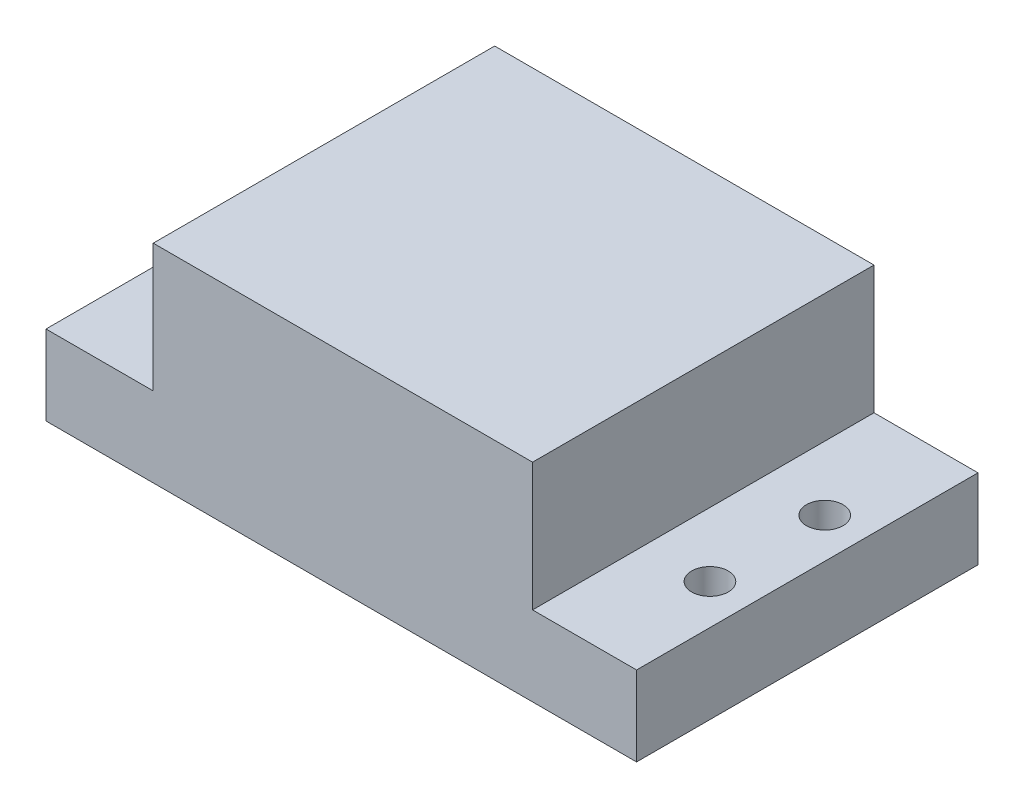
from build123d import *

# Parameters (mm, degrees)
SKETCH1_W           = 80.772
SKETCH1_H           = 46.7
BOSS_EXTRUDE1_DEPTH = 10.9
SKETCH3_R           = 2.5
CUT_EXTRUDE1_DEPTH  = 10.9
SKETCH8_W           = 51.8805497
SKETCH8_H           = 46.7
BOSS_EXTRUDE2_DEPTH = 17.5


with BuildPart() as part:
    # Sketch1 → Boss-Extrude1 (new body)
    with BuildSketch(Plane(origin=(0, 0, 0), x_dir=(1, 0, 0), z_dir=(0, 1, 0))):
        with Locations((4.445313725, -13.27745098)):
            Rectangle(SKETCH1_W, SKETCH1_H)
    extrude(amount=BOSS_EXTRUDE1_DEPTH)

    # Sketch3 → Cut-Extrude1 (cut)
    with BuildSketch(Plane(origin=(0, 10.9, 0), x_dir=(1, 0, 0), z_dir=(0, 1, 0))):
        with Locations(Location((-30.479686275, -5.42745098, 0), (0, 0, 270))):
            Circle(SKETCH3_R)
        with Locations(Location((-30.479686275, -21.12745098, 0), (0, 0, 270))):
            Circle(SKETCH3_R)
        with Locations(Location((39.370313725, -5.42745098, 0), (0, 0, 270))):
            Circle(SKETCH3_R)
        with Locations(Location((39.370313725, -21.12745098, 0), (0, 0, 270))):
            Circle(SKETCH3_R)
    extrude(amount=-CUT_EXTRUDE1_DEPTH, mode=Mode.SUBTRACT)

    # Sketch8 → Boss-Extrude2 (add)
    with BuildSketch(Plane(origin=(0, 10.9, 0), x_dir=(1, 0, 0), z_dir=(0, 1, 0))):
        with Locations((4.667038875, -13.27745098)):
            Rectangle(SKETCH8_W, SKETCH8_H)
    extrude(amount=BOSS_EXTRUDE2_DEPTH)


solid = part.part
